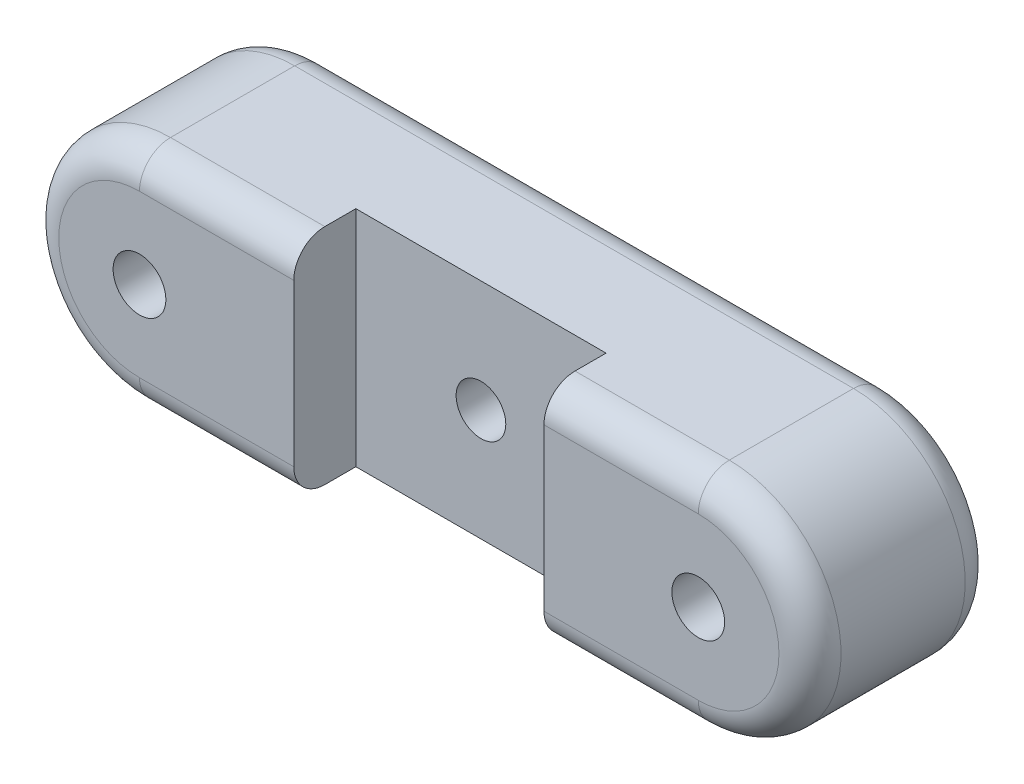
from build123d import *

# Parameters (mm, degrees)
BOSS_EXTRUDE1_START = 1220
SKETCH1_R           = 8.1
BOSS_EXTRUDE1_DEPTH = 30
SKETCH3_R           = 8.1
SKETCH3_R_2         = 4.25
BOSS_EXTRUDE2_DEPTH = 10
SKETCH4_W           = 40.3
SKETCH4_H           = 36
CUT_EXTRUDE1_DEPTH  = 10
FILLET1_R           = 5
FILLET2_R           = 5
SKETCH5_R           = 4
CUT_EXTRUDE2_DEPTH  = 50


with BuildPart() as part:
    # Sketch1 → Boss-Extrude1 (new body)
    with BuildSketch(Plane.XY.offset(BOSS_EXTRUDE1_START)):
        with BuildLine():
            Line((-45, 18), (45, 18))
            ThreePointArc((45, 18), (63, 0), (45, -18))
            Line((45, -18), (-45, -18))
            ThreePointArc((-45, -18), (-63, 0), (-45, 18))
        make_face()
        with Locations((-45, 0)):
            Circle(SKETCH1_R, mode=Mode.SUBTRACT)
        with Locations((45, 0)):
            Circle(SKETCH1_R, mode=Mode.SUBTRACT)
    extrude(amount=-BOSS_EXTRUDE1_DEPTH)

    # Sketch3 → Boss-Extrude2 (add)
    # profile 1 of 2: a face of its own
    with BuildSketch(Plane.XY.offset(1220)):
        with Locations((45, 0)):
            Circle(SKETCH3_R)
        with Locations((45, 0)):
            Circle(SKETCH3_R_2, mode=Mode.SUBTRACT)
    # profile 2 of 2: a face of its own
    with BuildSketch(Plane.XY.offset(1220)):
        with Locations((-45, 0)):
            Circle(SKETCH3_R)
        with Locations((-45, 0)):
            Circle(SKETCH3_R_2, mode=Mode.SUBTRACT)
    extrude(amount=-BOSS_EXTRUDE2_DEPTH)

    # Sketch4 → Cut-Extrude1 (cut)
    with BuildSketch(Plane.XY.offset(1220)):
        Rectangle(SKETCH4_W, SKETCH4_H)
    extrude(amount=-CUT_EXTRUDE1_DEPTH, mode=Mode.SUBTRACT)

    # Fillet1
    fillet1_edges = [part.edges().sort_by_distance(p)[0] for p in [
        (63, 0, 1190),
        (0, 18, 1190),
        (-63, 0, 1190),
        (0, -18, 1190),
    ]]
    fillet(fillet1_edges, radius=FILLET1_R)

    # Fillet2
    fillet2_edges = [part.edges().sort_by_distance(p)[0] for p in [
        (32.575, -18, 1220),
        (-32.575, 18, 1220),
        (32.575, 18, 1220),
        (63, 0, 1220),
        (-32.575, -18, 1220),
        (-63, 0, 1220),
    ]]
    fillet(fillet2_edges, radius=FILLET2_R)

    # Sketch5 → Cut-Extrude2 (cut)
    with BuildSketch(Plane.XY.offset(1210)):
        Circle(SKETCH5_R)
    extrude(amount=-CUT_EXTRUDE2_DEPTH, mode=Mode.SUBTRACT)


solid = part.part
